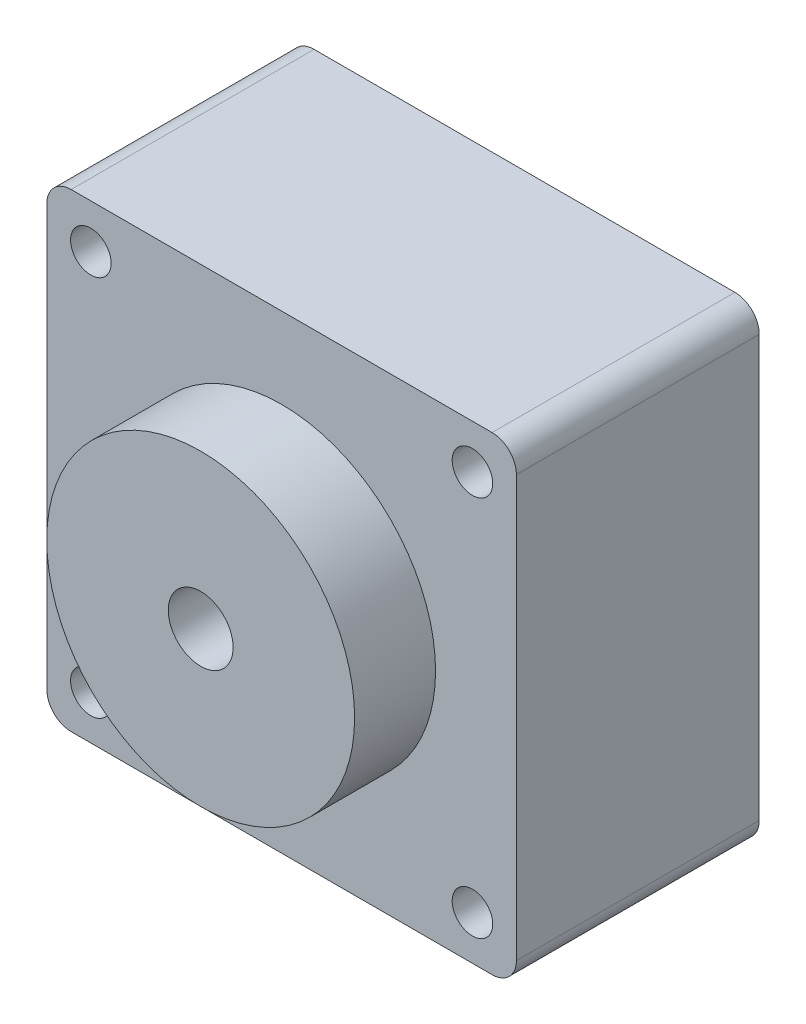
from build123d import *

# Parameters (mm, degrees)
SKETCH_1_W          = 58
SKETCH_1_H          = 58
EXTRUDE_1_DEPTH     = 30
SKETCH_2_R          = 19.015
EXTRUDE_2_DEPTH     = 10
SKETCH_3_R          = 4.005
CUT_EXTRUDE_2_DEPTH = 25
SKETCH_4_R          = 2.505
CUT_EXTRUDE_3_DEPTH = 88.338422244
FILLET_1_R          = 3
FILLET_2_R          = 3
FILLET_3_R          = 3
FILLET_4_R          = 3


with BuildPart() as part:
    # 草图1 → 凸台-拉伸1 (new body)
    with BuildSketch(Plane.XY):
        with Locations((29, 29)):
            Rectangle(SKETCH_1_W, SKETCH_1_H)
    extrude(amount=EXTRUDE_1_DEPTH)

    # 草图2 → 凸台-拉伸2 (add)
    with BuildSketch(Plane.XY.offset(30)):
        with Locations((29, 29)):
            Circle(SKETCH_2_R)
    extrude(amount=EXTRUDE_2_DEPTH)

    # 草图3 → 切除-拉伸2 (cut)
    with BuildSketch(Plane.XY.offset(40)):
        with Locations((29, 29)):
            Circle(SKETCH_3_R)
    extrude(amount=-CUT_EXTRUDE_2_DEPTH, mode=Mode.SUBTRACT)

    # 草图4 → 切除-拉伸3 (cut, through all)
    with BuildSketch(Plane.XY.offset(30)):
        with Locations((52.57, 52.57)):
            Circle(SKETCH_4_R)
        with Locations((5.43, 52.57)):
            Circle(SKETCH_4_R)
        with Locations((5.43, 5.43)):
            Circle(SKETCH_4_R)
        with Locations((52.57, 5.43)):
            Circle(SKETCH_4_R)
    extrude(amount=-CUT_EXTRUDE_3_DEPTH, mode=Mode.SUBTRACT)

    # 圆角1
    fillet_1_edges = [part.edges().sort_by_distance(p)[0] for p in [
        (58, 58, 15),
    ]]
    fillet(fillet_1_edges, radius=FILLET_1_R)

    # 圆角2
    fillet_2_edges = [part.edges().sort_by_distance(p)[0] for p in [
        (58, 0, 15),
    ]]
    fillet(fillet_2_edges, radius=FILLET_2_R)

    # 圆角3
    fillet_3_edges = [part.edges().sort_by_distance(p)[0] for p in [
        (0, 58, 15),
    ]]
    fillet(fillet_3_edges, radius=FILLET_3_R)

    # 圆角4
    fillet_4_edges = [part.edges().sort_by_distance(p)[0] for p in [
        (0, 0, 15),
    ]]
    fillet(fillet_4_edges, radius=FILLET_4_R)


solid = part.part
